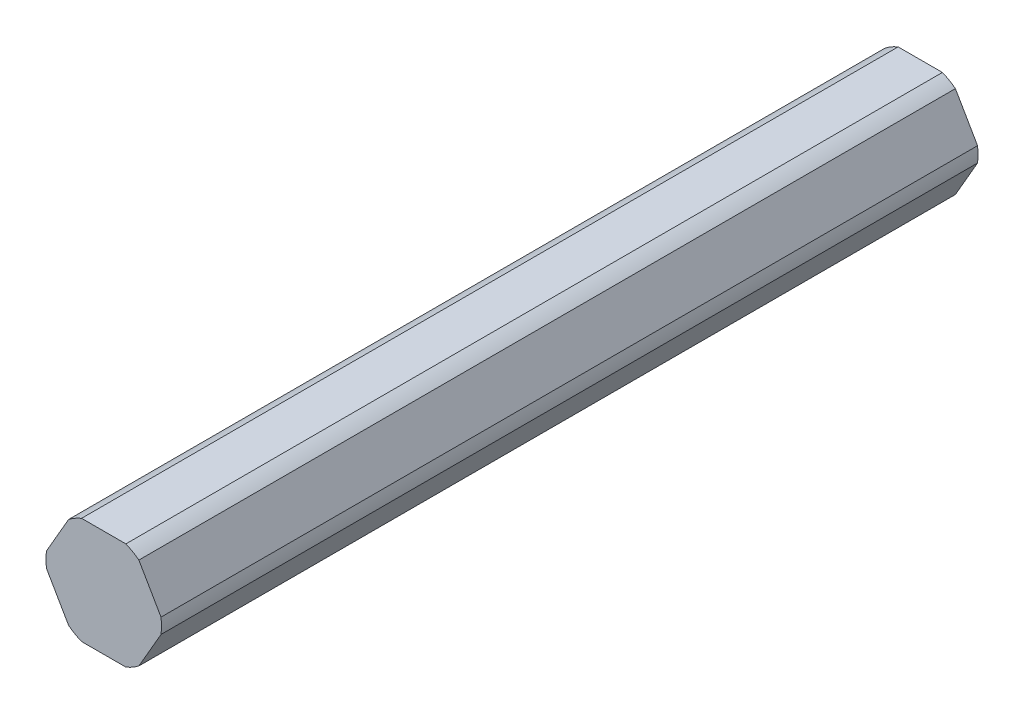
from build123d import *

# Parameters (mm, degrees)
BOSS_EXTRUDE1_DEPTH = 7.9375
BOSS_EXTRUDE4_DEPTH = 89.2175
CUT_EXTRUDE2_DEPTH  = 98.63800417


with BuildPart() as part:
    # Sketch2 → Boss-Extrude1 (new body)
    with BuildSketch(Plane.XY):
        Polygon((7.332348419, 0), (3.666174209, 6.35), (-3.666174209, 6.35), (-7.332348419, 0), (-3.666174209, -6.35), (3.666174209, -6.35), align=None)
    extrude(amount=BOSS_EXTRUDE1_DEPTH)

    # Sketch5 → Boss-Extrude4 (add)
    with BuildSketch(Plane.XY.offset(7.9375)):
        Polygon((7.332348419, 0), (3.666174209, 6.35), (-3.666174209, 6.35), (-7.332348419, 0), (-3.666174209, -6.35), (3.666174209, -6.35), align=None)
    extrude(amount=BOSS_EXTRUDE4_DEPTH)

    # Sketch6 → Cut-Extrude2 (cut, through all)
    with BuildSketch(Plane.XY.offset(97.155)):
        with BuildLine():
            ThreePointArc((-4.181770802, 5.456960506), (-3.4375, 5.953924651), (-2.634981025, 6.35))
            Line((-2.634981025, 6.35), (-3.666174209, 6.35))
            Line((-3.666174209, 6.35), (-4.181770802, 5.456960506))
        make_face()
        with BuildLine():
            ThreePointArc((2.634981025, 6.35), (3.4375, 5.953924651), (4.181770802, 5.456960506))
            Line((4.181770802, 5.456960506), (3.666174209, 6.35))
            Line((3.666174209, 6.35), (2.634981025, 6.35))
        make_face()
        with BuildLine():
            ThreePointArc((6.816751826, 0.893039494), (6.875, 0), (6.816751826, -0.893039494))
            Line((6.816751826, -0.893039494), (7.332348419, 0))
            Line((7.332348419, 0), (6.816751826, 0.893039494))
        make_face()
        with BuildLine():
            Line((2.634981025, -6.35), (3.666174209, -6.35))
            Line((3.666174209, -6.35), (4.181770802, -5.456960506))
            ThreePointArc((4.181770802, -5.456960506), (3.4375, -5.953924651), (2.634981025, -6.35))
        make_face()
        with BuildLine():
            Line((-3.666174209, -6.35), (-2.634981025, -6.35))
            ThreePointArc((-2.634981025, -6.35), (-3.4375, -5.953924651), (-4.181770802, -5.456960506))
            Line((-4.181770802, -5.456960506), (-3.666174209, -6.35))
        make_face()
        with BuildLine():
            Line((-7.332348419, 0), (-6.816751826, -0.893039494))
            ThreePointArc((-6.816751826, -0.893039494), (-6.875, 0), (-6.816751826, 0.893039494))
            Line((-6.816751826, 0.893039494), (-7.332348419, 0))
        make_face()
    extrude(amount=-CUT_EXTRUDE2_DEPTH, mode=Mode.SUBTRACT)


solid = part.part
